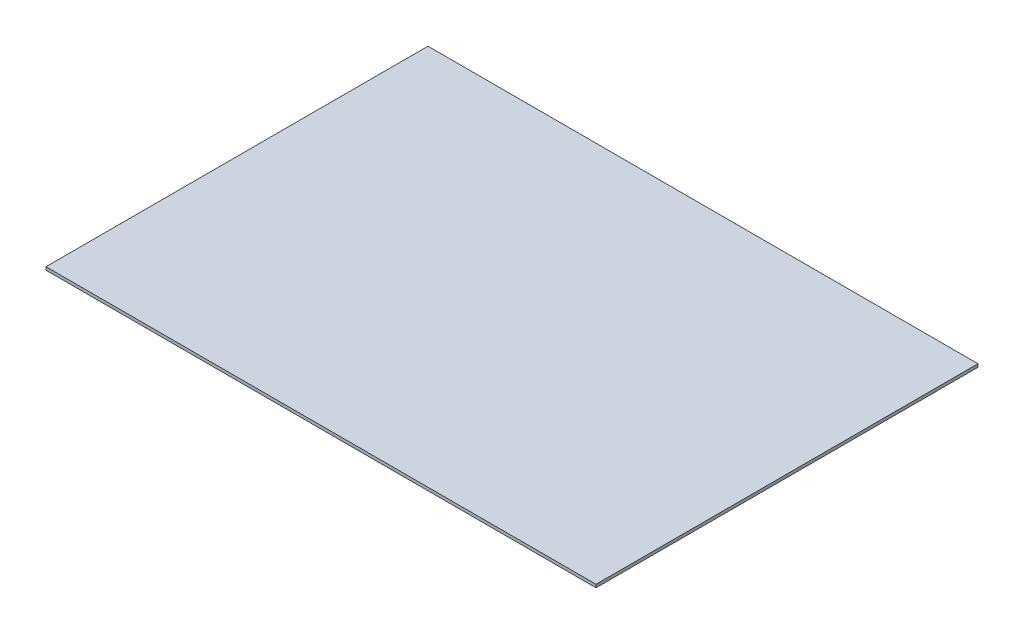
from build123d import *

# Parameters (mm, degrees)
SALIENTE_EXTRUIR1_DEPTH      = 0.5
SALIENTE_EXTRUIR1_DEPTH_BACK = 0.5
CROQUIS1_W                   = 180
CROQUIS1_H                   = 125


with BuildPart() as part:
    # Croquis1 → Saliente-Extruir1 (new, two sides: drawn at the far end of the back side and taken through both)
    with BuildSketch(Plane(origin=(0, 0, 0), x_dir=(1, 0, 0), z_dir=(0, 1, 0)).offset(-SALIENTE_EXTRUIR1_DEPTH_BACK)):
        Rectangle(CROQUIS1_W, CROQUIS1_H)
    extrude(amount=SALIENTE_EXTRUIR1_DEPTH + SALIENTE_EXTRUIR1_DEPTH_BACK)


solid = part.part
